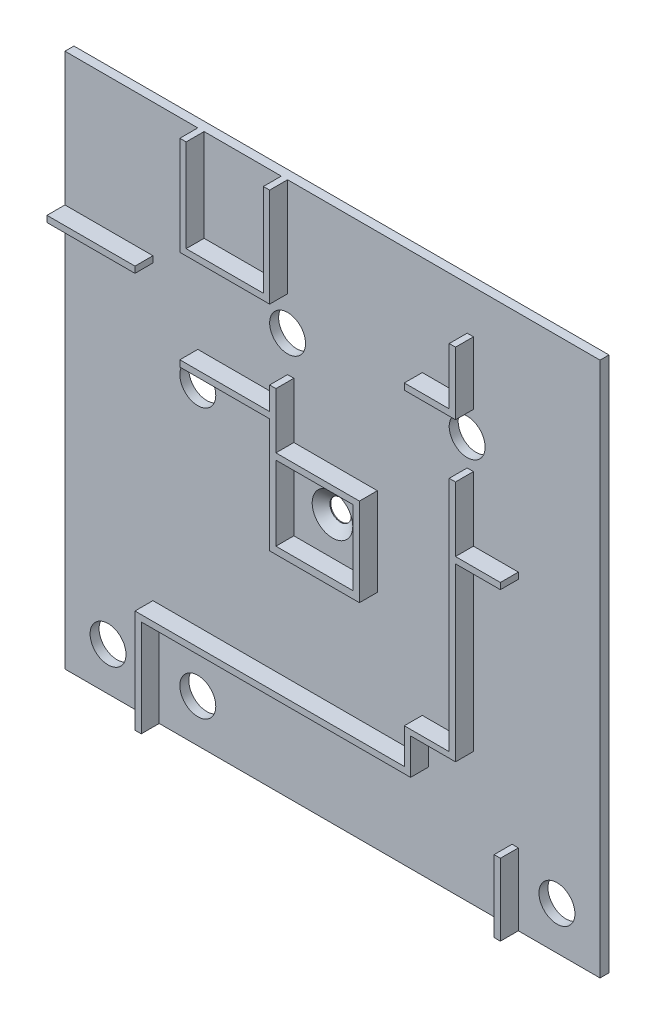
from build123d import *

# Parameters (mm, degrees)
SKETCH3_W           = 298
SKETCH3_H           = 298
BOSS_EXTRUDE2_DEPTH = 5
SKETCH4_R           = 10
CUT_EXTRUDE5_DEPTH  = 56
SKETCH5_W           = 43
SKETCH5_H           = 3.5
SKETCH5_W_2         = 49
SKETCH5_W_3         = 3.5
SKETCH5_H_2         = 49.019827061
SKETCH5_H_3         = 4.008691654
SKETCH5_W_4         = 25
SKETCH5_H_4         = 35
SKETCH5_H_5         = 16.5
SKETCH5_H_6         = 40
SKETCH5_W_5         = 50
BOSS_EXTRUDE6_DEPTH = 10


with BuildPart() as part:
    # Sketch3 → Boss-Extrude2 (new body)
    with BuildSketch(Plane.XY):
        Rectangle(SKETCH3_W, SKETCH3_H)
    extrude(amount=BOSS_EXTRUDE2_DEPTH)

    # Sketch4 → Cut-Extrude5 (cut)
    with BuildSketch(Plane.XY.offset(5)):
        with Locations((-75, 25)):
            Circle(SKETCH4_R)
        with Locations((-25, 75)):
            Circle(SKETCH4_R)
        with Locations((75, 75)):
            Circle(SKETCH4_R)
        with Locations((-75, -125)):
            Circle(SKETCH4_R)
        with Locations((-125, -125)):
            Circle(SKETCH4_R)
        with Locations((125, -125)):
            Circle(SKETCH4_R)
    extrude(amount=-CUT_EXTRUDE5_DEPTH, mode=Mode.SUBTRACT)

    # Sketch5 → Boss-Extrude6 (add)
    with BuildSketch(Plane.XY.offset(5)):
        Polygon((-71.5, 149), (-75, 149), (-75, 94), (-71.5, 94), (-71.5, 97.5), align=None)
        with Locations((-50, 95.75)):
            Rectangle(SKETCH5_W, SKETCH5_H)
        Polygon((-25, 149), (-28.5, 149), (-28.5, 97.5), (-28.5, 94), (-25, 94), align=None)
        with Locations((-124.5, 73.095100697)):
            Rectangle(SKETCH5_W_2, SKETCH5_H)
        Polygon((-25, 38.670579352), (-25, 24.019827061), (-21.5, 24.019827061), (-21.5, 55.019827061), (-25, 55.019827061), (-25, 42.170579352), align=None)
        with Locations((-23.25, -0.490086469)):
            Rectangle(SKETCH5_W_3, SKETCH5_H_2)
        with Locations((0, 22.269827061)):
            Rectangle(SKETCH5_W, SKETCH5_H)
        with Locations((23.25, -0.490086469)):
            Rectangle(SKETCH5_W_3, SKETCH5_H_2)
        with Locations((0, -22.995654173)):
            Rectangle(SKETCH5_W, SKETCH5_H_3)
        Polygon((75, -71.842185644), (75, -75), (78.5, -75), (78.5, 20.519827061), (78.5, 24.019827061), (78.5, 60), (75, 60), align=None)
        with Locations((91, 22.269827061)):
            Rectangle(SKETCH5_W_4, SKETCH5_H)
        with Locations((76.75, 107.5)):
            Rectangle(SKETCH5_W_3, SKETCH5_H_4)
        with Locations((62.5, 91.75)):
            Rectangle(SKETCH5_W_4, SKETCH5_H)
        Polygon((50, -71.842185644), (50, -75), (53.5, -75), (75, -75), (75, -71.842185644), align=None)
        with Locations((51.75, -83.25)):
            Rectangle(SKETCH5_W_3, SKETCH5_H_5)
        Polygon((-96.5, -91.5), (-96.5, -95), (53.5, -95), (53.5, -91.5), (50, -91.5), align=None)
        Polygon((-100, -91.5), (-100, -149), (-96.5, -149), (-96.5, -95), (-96.5, -91.5), align=None)
        with Locations((101.75, -129)):
            Rectangle(SKETCH5_W_3, SKETCH5_H_6)
        with Locations((-50, 40.420579352)):
            Rectangle(SKETCH5_W_5, SKETCH5_H)
    extrude(amount=BOSS_EXTRUDE6_DEPTH)

    # Sketch7 → CSK for 7/16 Flat Head Machine Screw (100)1 (revolve, cut)
    with BuildSketch(Plane(origin=(0, 0, 5), x_dir=(0, -1, 0), z_dir=(1, 0, 0))):
        Polygon((0, 0), (0, 5), (5.95249, 5), (5.95249, 4.489610968), (11.303, 0), align=None)
    revolve(axis=Axis((0, 0, 11.35), (0, 0, -1)), mode=Mode.SUBTRACT)


solid = part.part
